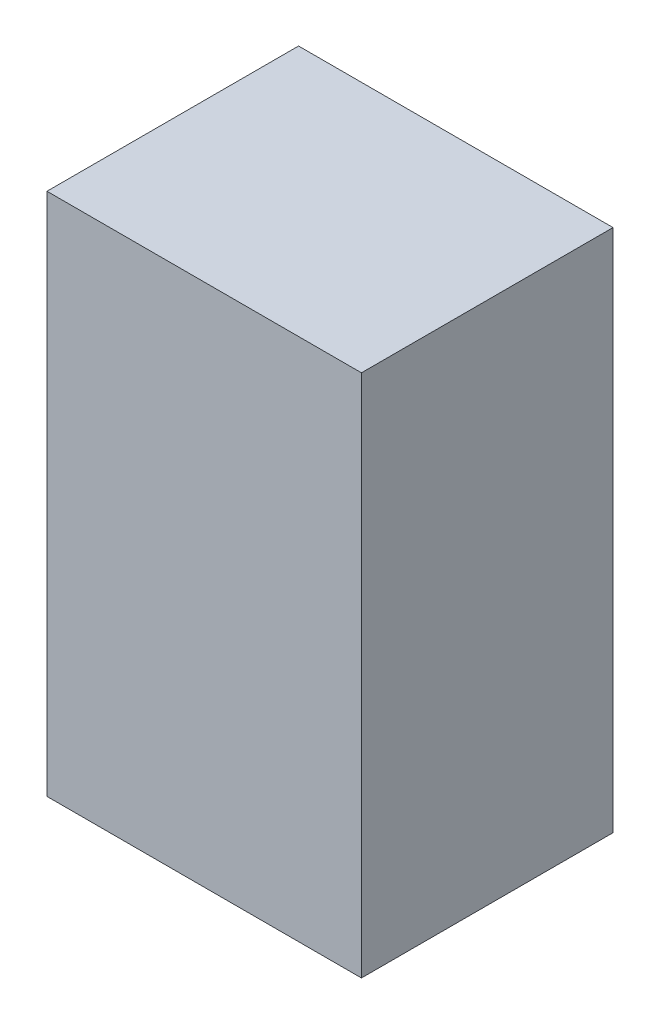
from build123d import *

# Parameters (mm, degrees)
SKETCH_1_W      = 6
SKETCH_1_H      = 10
EXTRUDE_1_DEPTH = 4.8


with BuildPart() as part:
    # 草图1 → 凸台-拉伸1 (new body)
    with BuildSketch(Plane.XY):
        with Locations((3, 5)):
            Rectangle(SKETCH_1_W, SKETCH_1_H)
    extrude(amount=EXTRUDE_1_DEPTH)


solid = part.part
